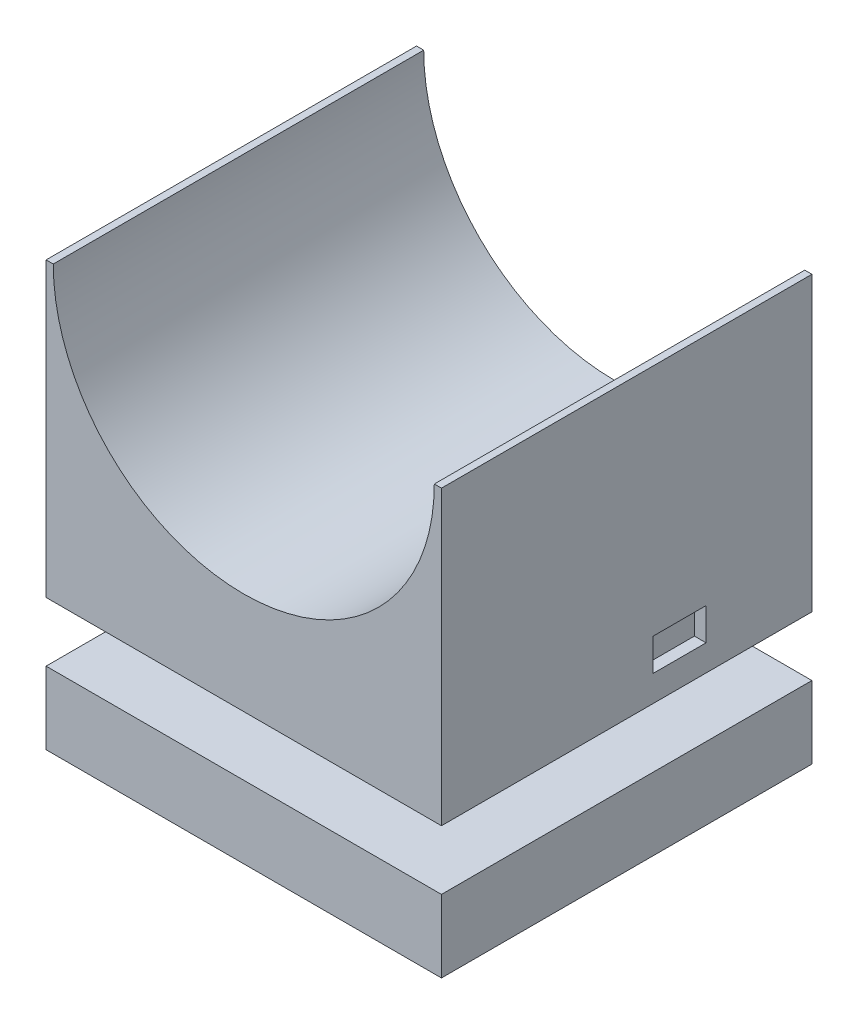
from build123d import *

# Parameters (mm, degrees)
BOSS_EXTRUDE1_DEPTH   = 88.9
SKETCH1_W             = 94.878512488
SKETCH1_H             = 17.376026141
BOSS_EXTRUDE1_2_DEPTH = 88.9
SKETCH8_W             = 87.134578152
SKETCH8_H             = 22.219668138
BOSS_EXTRUDE2_DEPTH   = 5.08
SKETCH9_W             = 87.134578152
SKETCH9_H             = 22.219668138
BOSS_EXTRUDE3_DEPTH   = 5.08
CUT_EXTRUDE1_DEPTH    = 12.7
SKETCH11_W            = 12.678767115
SKETCH11_H            = 25.288130555
BOSS_EXTRUDE4_DEPTH   = 6.35
BOSS_EXTRUDE5_DEPTH   = 12.7
SKETCH13_W            = 12.7
SKETCH13_H            = 7.741896913
CUT_EXTRUDE2_DEPTH    = 2.794


with BuildPart() as part:
    # Sketch1 → Boss-Extrude1 (new body)
    with BuildSketch(Plane.XY):
        with BuildLine():
            ThreePointArc((45.72, 0), (0, -45.72), (-45.72, 0))
            Line((-45.72, 0), (-47.439256244, 0))
            Line((-47.439256244, 0), (-47.439256244, -70.162974211))
            Line((-47.439256244, -70.162974211), (-43.567289076, -70.162974211))
            Line((-43.567289076, -70.162974211), (-43.567289076, -47.943306073))
            Line((-43.567289076, -47.943306073), (43.567289076, -47.943306073))
            Line((43.567289076, -47.943306073), (43.567289076, -70.162974211))
            Line((43.567289076, -70.162974211), (47.439256244, -70.162974211))
            Line((47.439256244, -70.162974211), (47.439256244, 0))
            Line((47.439256244, 0), (45.72, 0))
        make_face()
    extrude(amount=-BOSS_EXTRUDE1_DEPTH)

    # Sketch8 → Boss-Extrude2 (add)
    with BuildSketch(Plane.XY):
        with Locations((0, -59.053140142)):
            Rectangle(SKETCH8_W, SKETCH8_H)
    extrude(amount=-BOSS_EXTRUDE2_DEPTH)

    # Sketch9 → Boss-Extrude3 (add)
    with BuildSketch(Plane(origin=(0, 0, -88.9), x_dir=(-1, 0, 0), z_dir=(0, 0, -1))):
        with Locations((0, -59.053140142)):
            Rectangle(SKETCH9_W, SKETCH9_H)
    extrude(amount=-BOSS_EXTRUDE3_DEPTH)

    # Sketch13 → Cut-Extrude2 (cut)
    with BuildSketch(Plane(origin=(47.439256244, 0, 0), x_dir=(0, 0, -1), z_dir=(1, 0, 0))):
        with Locations((57.15, -60.02391027)):
            Rectangle(SKETCH13_W, SKETCH13_H)
    extrude(amount=-CUT_EXTRUDE2_DEPTH, mode=Mode.SUBTRACT)


with BuildPart() as body_2:
    # Sketch1 → Boss-Extrude1 2 (new body)
    with BuildSketch(Plane.XY):
        with Locations((0, -93.114019191)):
            Rectangle(SKETCH1_W, SKETCH1_H)
    extrude(amount=-BOSS_EXTRUDE1_2_DEPTH)

    # Sketch10 → Cut-Extrude1 (cut)
    with BuildSketch(Plane.XZ.offset(101.802032261)):
        with BuildLine():
            Line((-41.870605058, -6.461673731), (41.870605058, -6.461673731))
            ThreePointArc((41.870605058, -6.461673731), (43.666656283, -7.205622507), (44.410605058, -9.001673731))
            Line((44.410605058, -9.001673731), (44.410605058, -105.65673434))
            ThreePointArc((44.410605058, -105.65673434), (43.666656283, -107.452785564), (41.870605058, -108.19673434))
            Line((41.870605058, -108.19673434), (-41.870605058, -108.19673434))
            ThreePointArc((-41.870605058, -108.19673434), (-43.666656283, -107.452785564), (-44.410605058, -105.65673434))
            Line((-44.410605058, -105.65673434), (-44.410605058, -9.001673731))
            ThreePointArc((-44.410605058, -9.001673731), (-43.666656283, -7.205622507), (-41.870605058, -6.461673731))
        make_face()
    extrude(amount=-CUT_EXTRUDE1_DEPTH, mode=Mode.SUBTRACT)

    # Sketch11 → Boss-Extrude4 (add)
    with BuildSketch(Plane.ZY.offset(47.439256244)):
        with Locations((-57.297427525, -105.758084467)):
            Rectangle(SKETCH11_W, SKETCH11_H)
    extrude(amount=BOSS_EXTRUDE4_DEPTH)

    # Sketch12 → Boss-Extrude5 (add)
    with BuildSketch(Plane(origin=(0, 0, -63.636811082), x_dir=(-1, 0, 0), z_dir=(0, 0, -1))):
        Polygon((47.439256244, -118.402149745), (44.762238893, -115.725132393), (44.762238893, -110.660252831), (47.439256244, -107.98323548), align=None)
    extrude(amount=-BOSS_EXTRUDE5_DEPTH)


solid = Compound([part.part, body_2.part])
